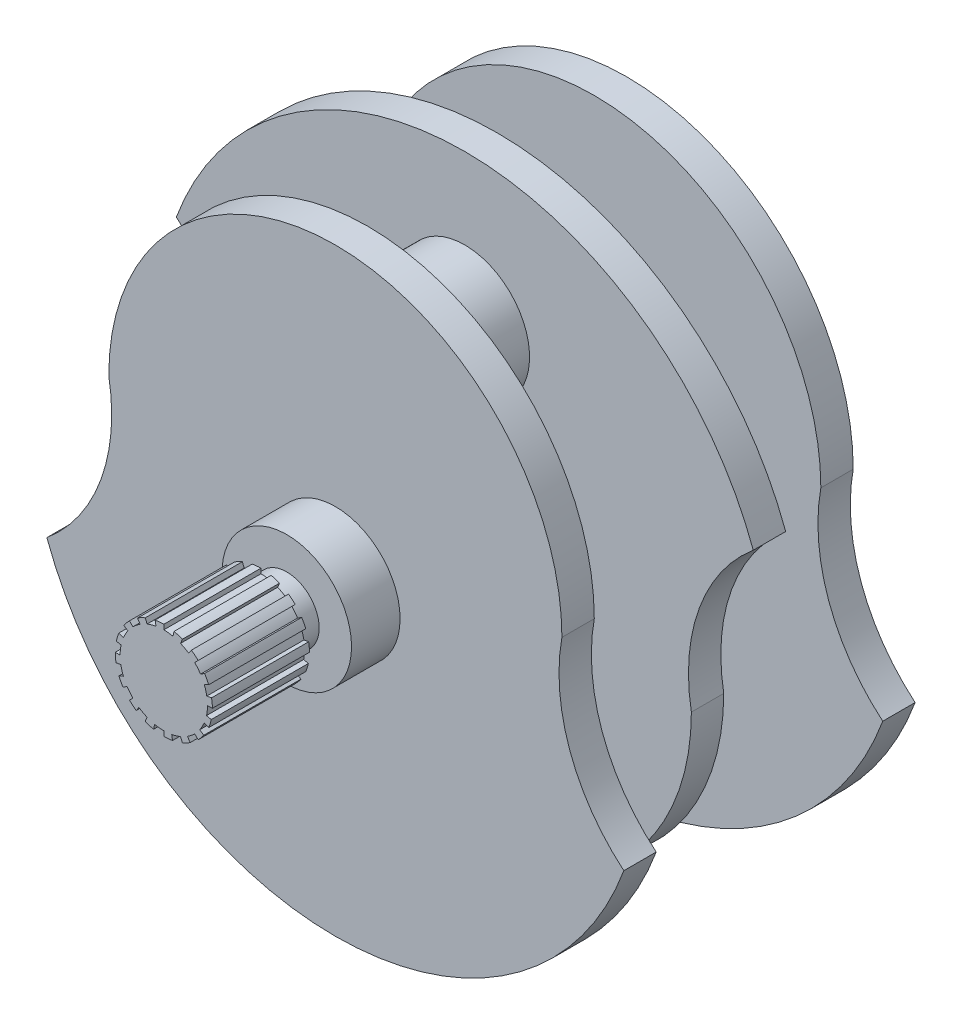
from build123d import *

# Parameters (mm, degrees)
SKETCH1_R            = 20
BOSS_EXTRUDE1_DEPTH  = 15
SKETCH2_R            = 10
BOSS_EXTRUDE2_DEPTH  = 8
SKETCH3_R            = 15
BOSS_EXTRUDE3_DEPTH  = 30
CUT_EXTRUDE1_START   = -30
CUT_EXTRUDE1_DEPTH   = 30
CIRPATTERN1_COUNT    = 16
BOSS_EXTRUDE5_DEPTH  = 10
SKETCH9_R            = 20
BOSS_EXTRUDE6_DEPTH  = 30
BOSS_EXTRUDE7_DEPTH  = 10
BOSS_EXTRUDE8_DEPTH  = 10
BOSS_EXTRUDE9_REACH  = 168.067
SKETCH14_R           = 20
SKETCH15_R           = 20
BOSS_EXTRUDE10_DEPTH = 15
SKETCH16_R           = 10
BOSS_EXTRUDE11_DEPTH = 8


with BuildPart() as part:
    # Sketch1 → Boss-Extrude1 (new body)
    with BuildSketch(Plane.XY):
        Circle(SKETCH1_R)
    extrude(amount=BOSS_EXTRUDE1_DEPTH)

    # Sketch2 → Boss-Extrude2 (add)
    with BuildSketch(Plane.XY.offset(15)):
        Circle(SKETCH2_R)
    extrude(amount=BOSS_EXTRUDE2_DEPTH)

    # Sketch3 → Boss-Extrude3 (add)
    with BuildSketch(Plane.XY.offset(23)):
        Circle(SKETCH3_R)
    extrude(amount=BOSS_EXTRUDE3_DEPTH)

    # Sketch5 → Cut-Extrude1 (cut)
    with BuildSketch(Plane.XY.offset(53).offset(CUT_EXTRUDE1_START)):
        with BuildLine():
            ThreePointArc((3.157894737, 14.663822859), (1.587869189, 14.915718938), (0, 15))
            Line((0, 15), (0, 13.5))
            ThreePointArc((0, 13.5), (1.42908227, 13.424147044), (2.842105263, 13.197440573))
            Line((2.842105263, 13.197440573), (3.157894737, 14.663822859))
        make_face()
    cut_extrude1 = extrude(amount=CUT_EXTRUDE1_DEPTH, mode=Mode.SUBTRACT)

    # CirPattern1: Cut-Extrude1 ×16 about axis
    cirpattern1_axis = Axis((0, 0, 0), (0, 0, 1))
    for i in range(1, CIRPATTERN1_COUNT):
        add(cut_extrude1.rotate(cirpattern1_axis, i * 360 / CIRPATTERN1_COUNT), mode=Mode.SUBTRACT)

    # Sketch8 → Boss-Extrude5 (add)
    with BuildSketch(Plane(origin=(0, 0, 0), x_dir=(-1, 0, 0), z_dir=(0, 0, -1))):
        with BuildLine():
            ThreePointArc((70, 20), (0, 90), (-70, 20))
            ThreePointArc((-70, 20), (-72.432874235, -9.018340852), (-89.130077464, -32.875968295))
            ThreePointArc((-89.130077464, -32.875968295), (0, -95), (89.130077464, -32.875968295))
            ThreePointArc((89.130077464, -32.875968295), (72.432874235, -9.018340852), (70, 20))
        make_face()
    extrude(amount=BOSS_EXTRUDE5_DEPTH)

    # Sketch9 → Boss-Extrude6 (add)
    with BuildSketch(Plane(origin=(0, 0, -10), x_dir=(-1, 0, 0), z_dir=(0, 0, -1))):
        with Locations((0, 50)):
            Circle(SKETCH9_R)
    extrude(amount=BOSS_EXTRUDE6_DEPTH)

    # Sketch10 → Boss-Extrude7 (add)
    with BuildSketch(Plane(origin=(0, 0, -40), x_dir=(-1, 0, 0), z_dir=(0, 0, -1))):
        with BuildLine():
            ThreePointArc((-70, -20), (0, -90), (70, -20))
            ThreePointArc((70, -20), (72.432874235, 9.018340852), (89.130077464, 32.875968295))
            ThreePointArc((89.130077464, 32.875968295), (0, 95), (-89.130077464, 32.875968295))
            ThreePointArc((-89.130077464, 32.875968295), (-72.432874235, 9.018340852), (-70, -20))
        make_face()
    extrude(amount=BOSS_EXTRUDE7_DEPTH)


with BuildPart() as body_2:
    # Sketch12 → Boss-Extrude8 (new body)
    with BuildSketch(Plane(origin=(0, 0, -80), x_dir=(-1, 0, 0), z_dir=(0, 0, -1))):
        with BuildLine():
            ThreePointArc((70, 20), (0, 90), (-70, 20))
            ThreePointArc((-70, 20), (-72.432874235, -9.018340852), (-89.130077464, -32.875968295))
            ThreePointArc((-89.130077464, -32.875968295), (0, -95), (89.130077464, -32.875968295))
            ThreePointArc((89.130077464, -32.875968295), (72.432874235, -9.018340852), (70, 20))
        make_face()
    extrude(amount=BOSS_EXTRUDE8_DEPTH)

    # Sketch14 → Boss-Extrude9 (add, up to next)
    with BuildSketch(Plane(origin=(0, 0, -50), x_dir=(-1, 0, 0), z_dir=(0, 0, -1)), mode=Mode.PRIVATE) as boss_extrude9_sk1:
        with Locations((0, -50)):
            Circle(SKETCH14_R)
    boss_extrude9_tool1 = extrude(boss_extrude9_sk1.sketch, amount=BOSS_EXTRUDE9_REACH, mode=Mode.PRIVATE) - body_2.part

    add(part.part)  # Boss-Extrude9 merges part
    add(boss_extrude9_tool1.solids().sort_by_distance((0, -50, -50))[0])

    # Sketch15 → Boss-Extrude10 (add)
    with BuildSketch(Plane(origin=(0, 0, -90), x_dir=(-1, 0, 0), z_dir=(0, 0, -1))):
        with Locations(Location((0, 0, 0), (0, 0, 180))):
            Circle(SKETCH15_R)
    extrude(amount=BOSS_EXTRUDE10_DEPTH)

    # Sketch16 → Boss-Extrude11 (add)
    with BuildSketch(Plane(origin=(0, 0, -105), x_dir=(-1, 0, 0), z_dir=(0, 0, -1))):
        with Locations(Location((0, 0, 0), (0, 0, 180))):
            Circle(SKETCH16_R)
    extrude(amount=BOSS_EXTRUDE11_DEPTH)


solid = body_2.part
